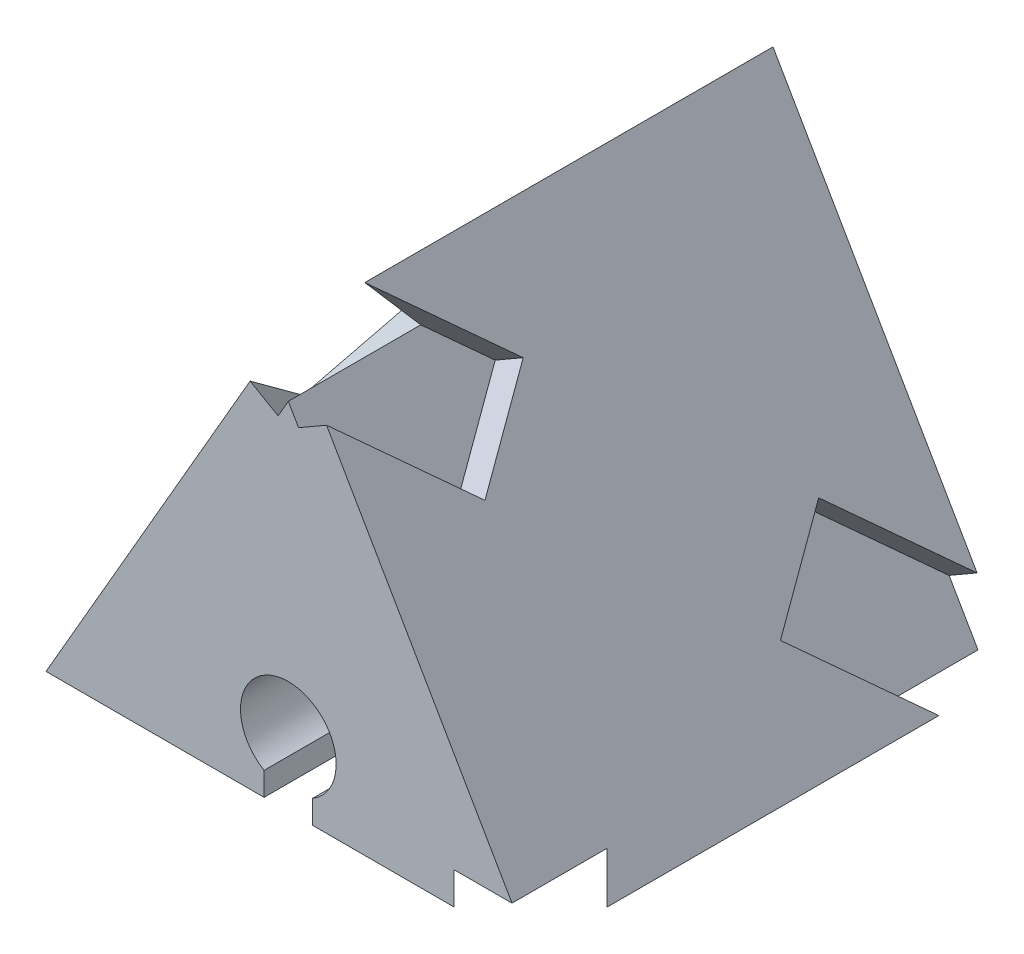
from build123d import *

# Parameters (mm, degrees)
MAIN_TRAPIZOID_DEPTH = 38.1
CUT_EXTRUDE3_DEPTH   = 64.181702256
MARKER_CHANNEL_DEPTH = 2.54


with BuildPart() as part:
    # Sketch1 → Main trapizoid (new body)
    with BuildSketch(Plane.XY):
        Polygon((0, 0), (19.05, 32.995567884), (38.1, 0), align=None)
    extrude(amount=-MAIN_TRAPIZOID_DEPTH)

    # Sketch15 → Cut-Extrude3 (cut, through all)
    with BuildSketch(Plane.XY.offset(-38.1)):
        with BuildLine():
            Line((17.145, 0), (17.145, 1.839234714))
            ThreePointArc((17.145, 1.839234714), (19.05, 8.8392), (20.955, 1.839234714))
            Line((20.955, 1.839234714), (20.955, 0))
            Line((20.955, 0), (17.145, 0))
        make_face()
    extrude(amount=CUT_EXTRUDE3_DEPTH, mode=Mode.SUBTRACT)

    # Sketch4 → Marker channel (cut)
    with BuildSketch(Plane(origin=(0, 0, 0), x_dir=(0, 0, 1), z_dir=(-0.8660254037844386, 0.5000000000000001, 0))):
        Polygon((2.773894864, 46.88348226), (8.78348226, 40.873894864), (-8.302387048, 23.788025556), (-14.311974444, 29.797612952), align=None)
        Polygon((-23.788025556, 8.302387048), (-29.797612952, 14.311974444), (-46.88348226, -2.773894864), (-40.873894864, -8.78348226), align=None)
    marker_channel = extrude(amount=-MARKER_CHANNEL_DEPTH, mode=Mode.SUBTRACT)

    # Mirror1: Marker channel across plane
    add(marker_channel.mirror(Plane.ZY.offset(-19.05)), mode=Mode.SUBTRACT)

    # Mirror2: Marker channel across plane
    add(marker_channel.mirror(Plane(origin=(0, 0, 0), x_dir=(0, 0, 1), z_dir=(-0.5000000000000001, 0.8660254037844386, 0))), mode=Mode.SUBTRACT)


solid = part.part
